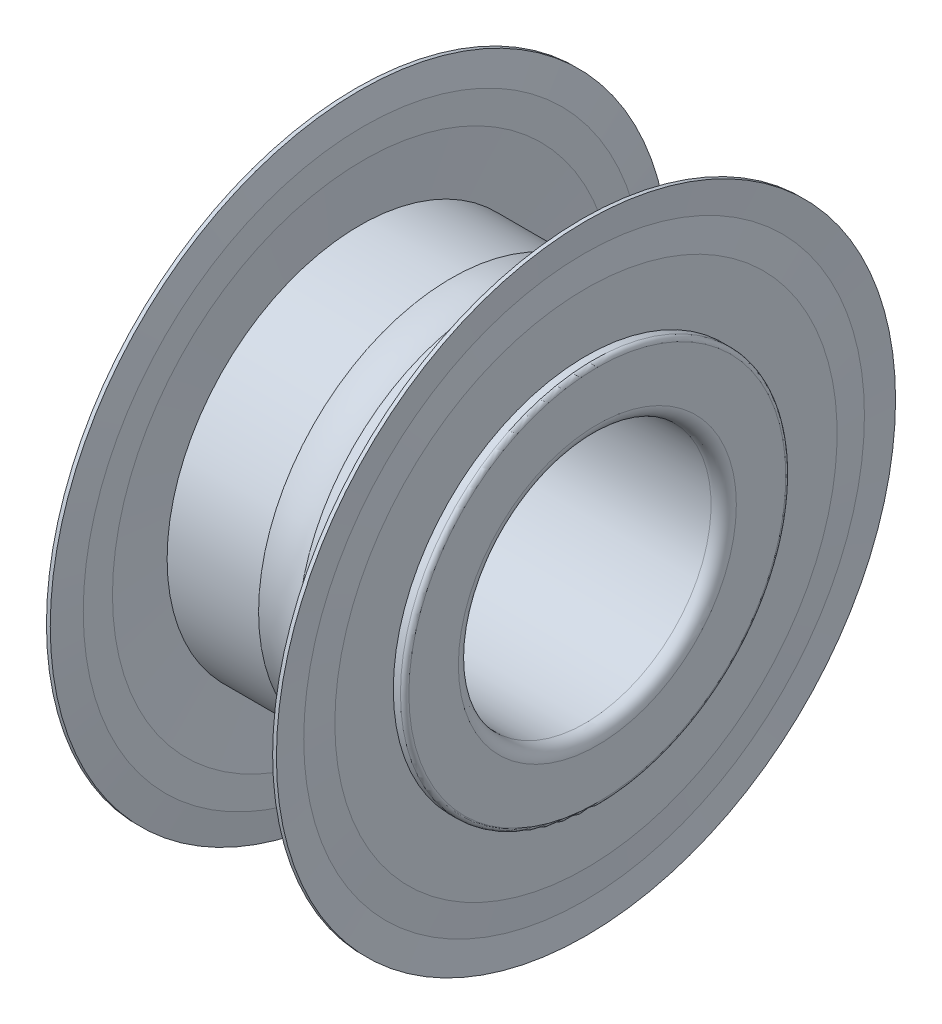
from build123d import *


with BuildPart() as part:
    # Sketch1 → Revolução1 (revolve)
    with BuildSketch(Plane.XY, mode=Mode.PRIVATE) as revolu_o1_sk:
        with BuildLine():
            Line((0, 2.983333333), (0, 2.2))
            ThreePointArc((0, 2.2), (0.058578644, 2.058578644), (0.2, 2))
            Line((0.2, 2), (3.8, 2))
            ThreePointArc((3.8, 2), (3.941421356, 2.058578644), (4, 2.2))
            Line((4, 2.2), (4, 2.983333333))
            ThreePointArc((4, 2.983333333), (3.980473785, 3.030473785), (3.933333333, 3.05))
            Line((3.933333333, 3.05), (2.3122499, 3.05))
            ThreePointArc((2.3122499, 3.05), (2, 3), (1.6877501, 3.05))
            Line((1.6877501, 3.05), (0.066666667, 3.05))
            ThreePointArc((0.066666667, 3.05), (0.019526215, 3.030473785), (0, 2.983333333))
        make_face()
    revolve(revolu_o1_sk.sketch.rotate(Axis((50, 0, 0), (-1, 0, 0)), 270), axis=Axis((50, 0, 0), (-1, 0, 0)))

    # Sketch2 → Revolução2 (revolve)
    with BuildSketch(Plane.XY, mode=Mode.PRIVATE) as revolu_o2_sk:
        Polygon((0.18, 4.9), (0.21, 4.4375), (0.18, 3.975), (0.18, 3.05), (0.24, 3.05), (0.3, 3.975), (0.3, 4.4375), (0.24, 4.9), align=None)
    revolve(revolu_o2_sk.sketch.rotate(Axis((50, 0, 0), (-1, 0, 0)), 270), axis=Axis((50, 0, 0), (-1, 0, 0)))

    # Sketch3 → Revolução3 (revolve)
    with BuildSketch(Plane.XY, mode=Mode.PRIVATE) as revolu_o3_sk:
        Polygon((3.7, 4.4375), (3.7, 3.975), (3.76, 3.05), (3.82, 3.05), (3.82, 3.975), (3.79, 4.4375), (3.82, 4.9), (3.76, 4.9), align=None)
    revolve(revolu_o3_sk.sketch.rotate(Axis((50, 0, 0), (-1, 0, 0)), 270), axis=Axis((50, 0, 0), (-1, 0, 0)))


solid = part.part
